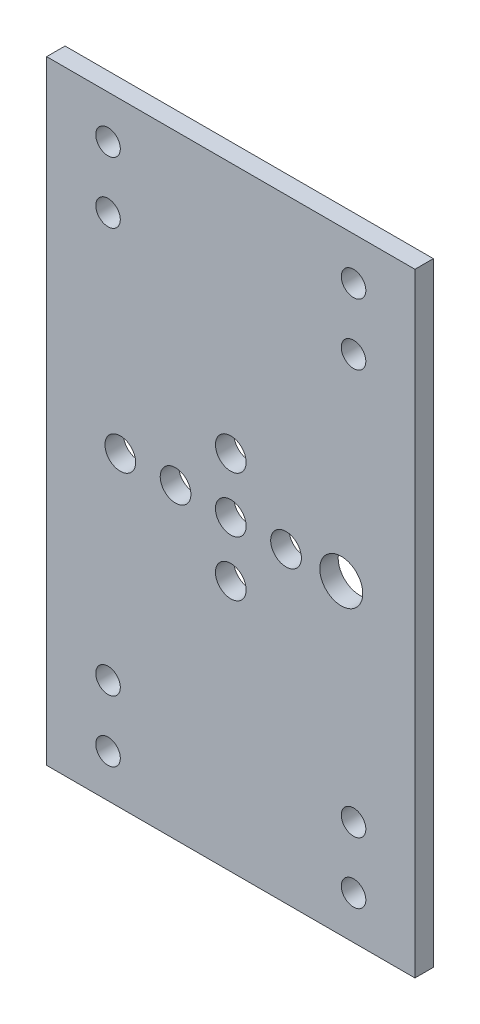
from build123d import *

# Parameters (mm, degrees)
SKETCH_1_W      = 60
SKETCH_1_H      = 100
SKETCH_1_R      = 2.5
SKETCH_1_R_2    = 2
SKETCH_1_R_3    = 3.5
EXTRUDE_1_DEPTH = 3


with BuildPart() as part:
    # Эскиз1 → Бобышка-Вытянуть1 (new body)
    with BuildSketch(Plane.XY):
        with Locations((-30, 50)):
            Rectangle(SKETCH_1_W, SKETCH_1_H)
        with Locations((-30, 50)):
            Circle(SKETCH_1_R, mode=Mode.SUBTRACT)
        with Locations((-21, 50)):
            Circle(SKETCH_1_R, mode=Mode.SUBTRACT)
        with Locations(Location((-39, 50, 0), (0, 0, 180))):
            Circle(SKETCH_1_R, mode=Mode.SUBTRACT)
        with Locations((-30, 41)):
            Circle(SKETCH_1_R, mode=Mode.SUBTRACT)
        with Locations(Location((-30, 59, 0), (0, 0, 180))):
            Circle(SKETCH_1_R, mode=Mode.SUBTRACT)
        with Locations((-50, 93)):
            Circle(SKETCH_1_R_2, mode=Mode.SUBTRACT)
        with Locations((-50, 83)):
            Circle(SKETCH_1_R_2, mode=Mode.SUBTRACT)
        with Locations(Location((-10, 83, 0), (0, 0, 180))):
            Circle(SKETCH_1_R_2, mode=Mode.SUBTRACT)
        with Locations(Location((-10, 93, 0), (0, 0, 180))):
            Circle(SKETCH_1_R_2, mode=Mode.SUBTRACT)
        with Locations((-10, 17)):
            Circle(SKETCH_1_R_2, mode=Mode.SUBTRACT)
        with Locations((-10, 7)):
            Circle(SKETCH_1_R_2, mode=Mode.SUBTRACT)
        with Locations(Location((-50, 7, 0), (0, 0, 180))):
            Circle(SKETCH_1_R_2, mode=Mode.SUBTRACT)
        with Locations(Location((-50, 17, 0), (0, 0, 180))):
            Circle(SKETCH_1_R_2, mode=Mode.SUBTRACT)
        with Locations((-48, 50)):
            Circle(SKETCH_1_R, mode=Mode.SUBTRACT)
        with Locations((-12, 50)):
            Circle(SKETCH_1_R_3, mode=Mode.SUBTRACT)
    extrude(amount=EXTRUDE_1_DEPTH)


solid = part.part
